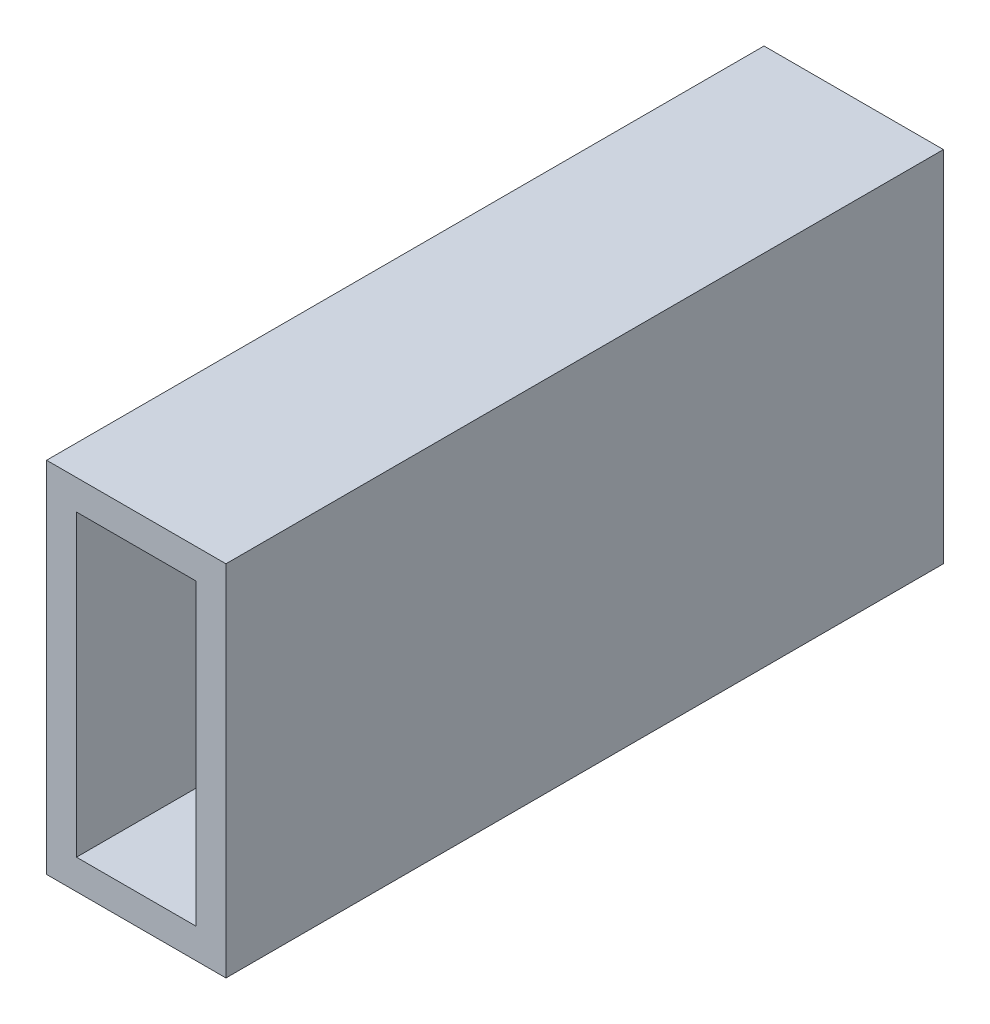
from build123d import *

# Parameters (mm, degrees)
SKETCH1_W           = 19.05
SKETCH1_H           = 38.1
SKETCH1_W_2         = 12.7
SKETCH1_H_2         = 31.75
BOSS_EXTRUDE1_DEPTH = 76.2


with BuildPart() as part:
    # Sketch1 → Boss-Extrude1 (new body)
    with BuildSketch(Plane.XY):
        Rectangle(SKETCH1_W, SKETCH1_H)
        Rectangle(SKETCH1_W_2, SKETCH1_H_2, mode=Mode.SUBTRACT)
    extrude(amount=BOSS_EXTRUDE1_DEPTH)


solid = part.part
